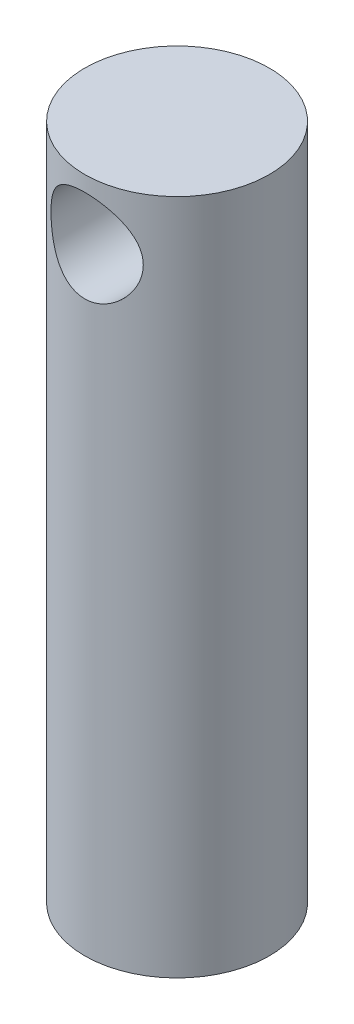
from build123d import *

# Parameters (mm, degrees)
SKETCH1_R           = 15
BOSS_EXTRUDE1_DEPTH = 110
SKETCH2_R           = 7.5
CUT_EXTRUDE1_DEPTH  = 40


with BuildPart() as part:
    # Sketch1 → Boss-Extrude1 (new body)
    with BuildSketch(Plane(origin=(0, 0, 0), x_dir=(1, 0, 0), z_dir=(0, 1, 0))):
        with Locations(Location((0, 0, 0), (0, 0, 270))):
            Circle(SKETCH1_R)
    extrude(amount=BOSS_EXTRUDE1_DEPTH)

    # Sketch2 → Cut-Extrude1 (cut)
    with BuildSketch(Plane.XY.offset(20)):
        with Locations(Location((0, 100, 0), (0, 0, 90.000000014))):
            Circle(SKETCH2_R)
    extrude(amount=-CUT_EXTRUDE1_DEPTH, mode=Mode.SUBTRACT)


solid = part.part
